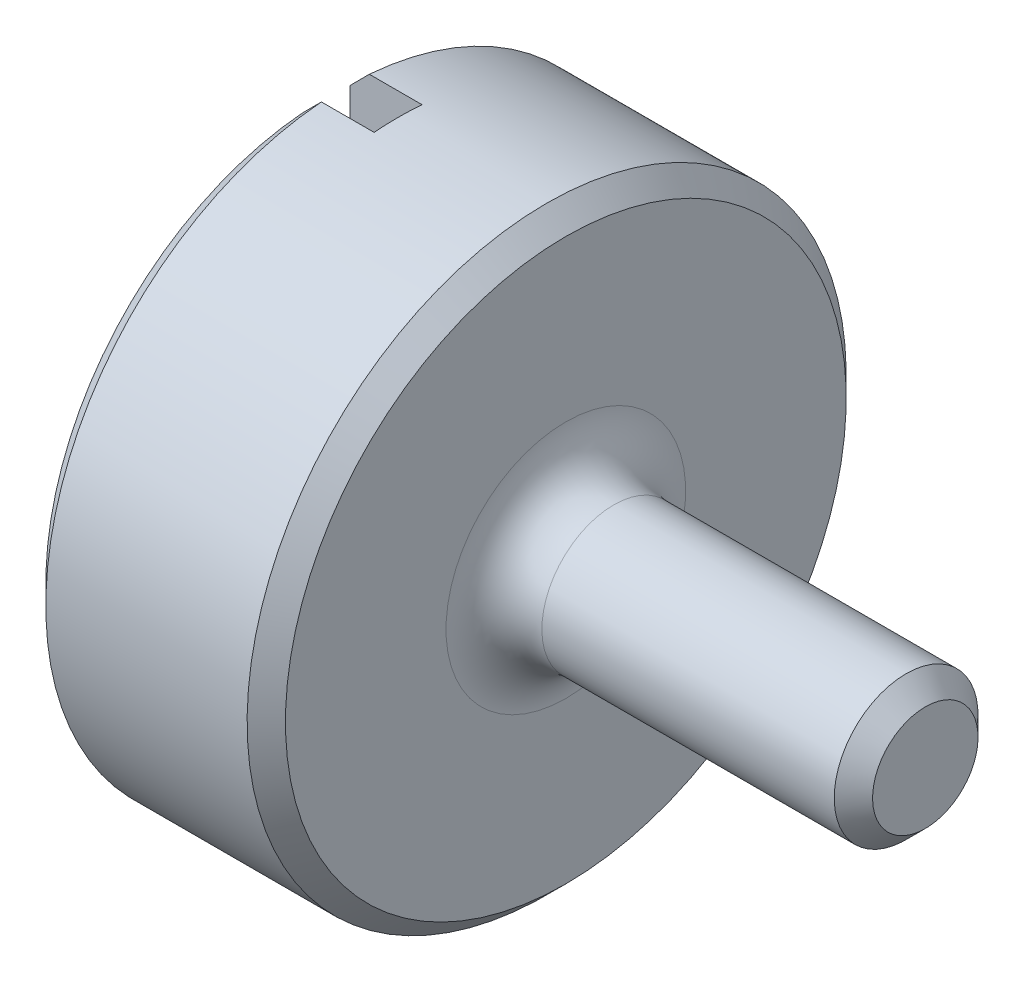
from build123d import *

# Parameters (mm, degrees)
CHANFRO1_SIZE         = 0.8
FILETE1_R             = 2
ESBO_O2_W             = 2
ESBO_O2_H             = 30
CORTE_EXTRUS_O1_DEPTH = 3


with BuildPart() as part:
    # Esboço1 → Revolução1 (revolve)
    with BuildSketch(Plane.XY):
        Polygon((0, 0), (0, 12.5), (10, 12.5), (10, 3), (25, 3), (25, 0), align=None)
    revolve(axis=Axis((25, 0, 0), (-1, 0, 0)))

    # Chanfro1
    chanfro1_edges = [part.edges().sort_by_distance(p)[0] for p in [
        (25, -3, 0),
        (10, -12.5, 0),
        (0, -12.5, 0),
    ]]
    chamfer(chanfro1_edges, length=CHANFRO1_SIZE)

    # Filete1
    filete1_edges = [part.edges().sort_by_distance(p)[0] for p in [
        (10, -3, 0),
    ]]
    fillet(filete1_edges, radius=FILETE1_R)

    # Esboço2 → Corte-extrusão1 (cut)
    with BuildSketch(Plane.ZY):
        Rectangle(ESBO_O2_W, ESBO_O2_H)
    extrude(amount=-CORTE_EXTRUS_O1_DEPTH, mode=Mode.SUBTRACT)


solid = part.part
